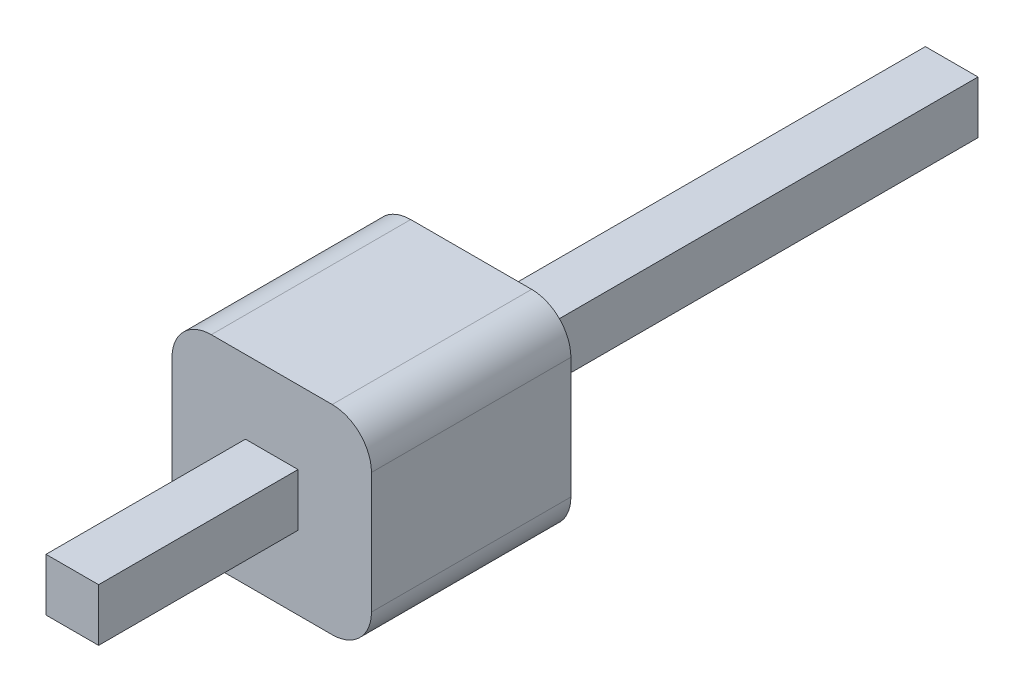
from build123d import *

# Parameters (mm, degrees)
SKETCH_1_W      = 2.54
SKETCH_1_H      = 2.54
EXTRUDE_1_DEPTH = 2.54
SKETCH_2_W      = 0.67
SKETCH_2_H      = 0.67
FILLET_1_R      = 0.5


with BuildPart() as part:
    # 草图1 → 拉伸1 (new body)
    with BuildSketch(Plane.XY):
        Rectangle(SKETCH_1_W, SKETCH_1_H)
    extrude(amount=EXTRUDE_1_DEPTH)

    # 扫描1: sweep along a path in 草图3
    with BuildLine(Plane(origin=(0, 0, 0), x_dir=(0, 0, -1), z_dir=(1, 0, 0))) as sweep_1_path:
        Line((6.12, -0.01), (-5.08, -0.01))
    # 草图2 → 扫描1 (sweep)
    with BuildSketch(Plane(origin=(0, 0, 5.08), x_dir=(-1, 0, 0), z_dir=(0, 0, -1))):
        Rectangle(SKETCH_2_W, SKETCH_2_H)
    sweep(path=sweep_1_path.line)

    # 圆角1
    fillet_1_edges = [part.edges().sort_by_distance(p)[0] for p in [
        (-1.27, 1.27, 1.27),
        (1.27, 1.27, 1.27),
        (1.27, -1.27, 1.27),
        (-1.27, -1.27, 1.27),
    ]]
    fillet(fillet_1_edges, radius=FILLET_1_R)


solid = part.part
